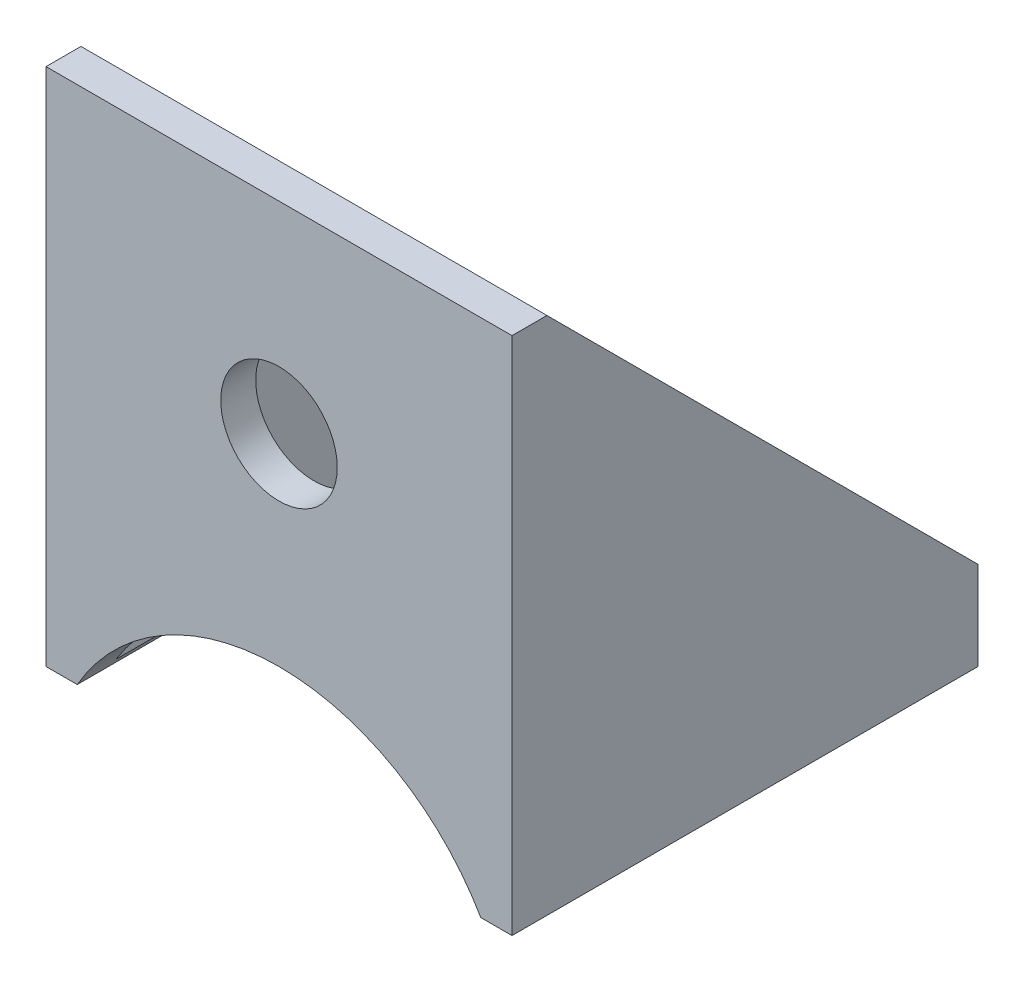
from build123d import *

# Parameters (mm, degrees)
BOSS_EXTRUDE1_DEPTH = 34.671
CUT_EXTRUDE1_DEPTH  = 45.816606755
SKETCH3_R           = 3.175
CUT_EXTRUDE2_DEPTH  = 45.816606755
CUT_EXTRUDE3_DEPTH  = 45.816606755


with BuildPart() as part:
    # Sketch1 → Boss-Extrude1 (new body)
    with BuildSketch(Plane(origin=(0, 0, 0), x_dir=(1, 0, 0), z_dir=(0, 1, 0))):
        Polygon((-12.7, 12.7), (-12.7, -12.7), (12.7, -12.7), (12.7, 12.7), (10.795, 12.7), (10.795, -10.795), (-10.795, -10.795), (-10.795, 12.7), align=None)
    extrude(amount=BOSS_EXTRUDE1_DEPTH)

    # Sketch2 → Cut-Extrude1 (cut, through all)
    with BuildSketch(Plane.ZY.offset(12.7)):
        Polygon((-12.7, 11.176), (10.795, 34.671), (-12.7, 34.671), align=None)
    extrude(amount=-CUT_EXTRUDE1_DEPTH, mode=Mode.SUBTRACT)

    # Sketch3 → Cut-Extrude2 (cut, through all)
    with BuildSketch(Plane.XY.offset(12.7)):
        with Locations((0, 23.6855)):
            Circle(SKETCH3_R)
    extrude(amount=-CUT_EXTRUDE2_DEPTH, mode=Mode.SUBTRACT)

    # Sketch4 → Cut-Extrude3 (cut, through all)
    with BuildSketch(Plane.XY.offset(12.7)):
        with BuildLine():
            Line((-12.7, 0), (12.7, 0))
            Line((12.7, 0), (12.7, 6.35))
            Line((12.7, 6.35), (10.998522628, 6.35))
            ThreePointArc((10.998522628, 6.35), (0, 12.7), (-10.998522628, 6.35))
            Line((-10.998522628, 6.35), (-12.7, 6.35))
            Line((-12.7, 6.35), (-12.7, 0))
        make_face()
    extrude(amount=-CUT_EXTRUDE3_DEPTH, mode=Mode.SUBTRACT)


solid = part.part
